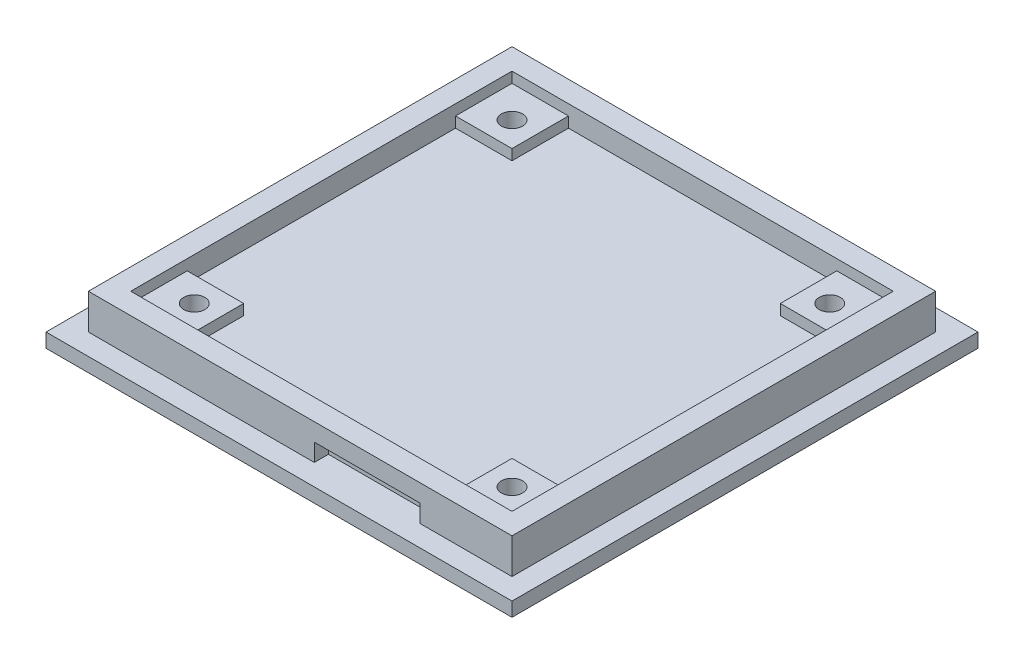
from build123d import *

# Parameters (mm, degrees)
SKETCH1_W           = 60
SKETCH1_H           = 60
BOSS_EXTRUDE1_DEPTH = 5
SKETCH2_W           = 54
SKETCH2_H           = 54
CUT_EXTRUDE1_DEPTH  = 3
SKETCH5_W           = 15
SKETCH5_H           = 2.5
CUT_EXTRUDE3_DEPTH  = 2
SKETCH6_W           = 12
SKETCH6_H           = 2
CUT_EXTRUDE4_DEPTH  = 2
SKETCH7_W           = 66
SKETCH7_H           = 66
BOSS_EXTRUDE3_DEPTH = 2
SKETCH4_W           = 8
SKETCH4_H           = 8
BOSS_EXTRUDE2_DEPTH = 1.5
SKETCH3_R           = 1.5
CUT_EXTRUDE2_DEPTH  = 5.5


with BuildPart() as part:
    # Sketch1 → Boss-Extrude1 (new body)
    with BuildSketch(Plane(origin=(0, 0, 0), x_dir=(1, 0, 0), z_dir=(0, 1, 0))):
        Rectangle(SKETCH1_W, SKETCH1_H)
    extrude(amount=BOSS_EXTRUDE1_DEPTH)

    # Sketch2 → Cut-Extrude1 (cut)
    with BuildSketch(Plane(origin=(0, 5, 0), x_dir=(1, 0, 0), z_dir=(0, 1, 0))):
        Rectangle(SKETCH2_W, SKETCH2_H)
    extrude(amount=-CUT_EXTRUDE1_DEPTH, mode=Mode.SUBTRACT)

    # Sketch5 → Cut-Extrude3 (cut)
    with BuildSketch(Plane(origin=(0, 0, 30), x_dir=(-1, 0, 0), z_dir=(0, 0, -1))):
        with Locations((-9.5, 1.25)):
            Rectangle(SKETCH5_W, SKETCH5_H)
    extrude(amount=CUT_EXTRUDE3_DEPTH, mode=Mode.SUBTRACT)

    # Sketch6 → Cut-Extrude4 (cut)
    with BuildSketch(Plane(origin=(0, 0, -30), x_dir=(-1, 0, 0), z_dir=(0, 0, -1))):
        with Locations((-17.5, 1)):
            Rectangle(SKETCH6_W, SKETCH6_H)
    extrude(amount=-CUT_EXTRUDE4_DEPTH, mode=Mode.SUBTRACT)

    # Sketch7 → Boss-Extrude3 (add)
    with BuildSketch(Plane.XZ):
        Rectangle(SKETCH7_W, SKETCH7_H)
    extrude(amount=BOSS_EXTRUDE3_DEPTH)

    # Sketch4 → Boss-Extrude2 (add)
    with BuildSketch(Plane(origin=(0, 2, 0), x_dir=(1, 0, 0), z_dir=(0, 1, 0))):
        with Locations((23, 23)):
            Rectangle(SKETCH4_W, SKETCH4_H)
        with Locations((-23, 23)):
            Rectangle(SKETCH4_W, SKETCH4_H)
        with Locations((23, -23)):
            Rectangle(SKETCH4_W, SKETCH4_H)
        with Locations((-23, -23)):
            Rectangle(SKETCH4_W, SKETCH4_H)
    extrude(amount=BOSS_EXTRUDE2_DEPTH)

    # Sketch3 → Cut-Extrude2 (cut)
    with BuildSketch(Plane(origin=(0, 3.5, 0), x_dir=(1, 0, 0), z_dir=(0, 1, 0))):
        with Locations(Location((-22.5, 22.5, 0), (0, 0, 270))):
            Circle(SKETCH3_R)
        with Locations(Location((22.5, 22.5, 0), (0, 0, 270))):
            Circle(SKETCH3_R)
        with Locations(Location((22.5, -22.5, 0), (0, 0, 270))):
            Circle(SKETCH3_R)
        with Locations(Location((-22.5, -22.5, 0), (0, 0, 270))):
            Circle(SKETCH3_R)
    extrude(amount=-CUT_EXTRUDE2_DEPTH, mode=Mode.SUBTRACT)


solid = part.part
